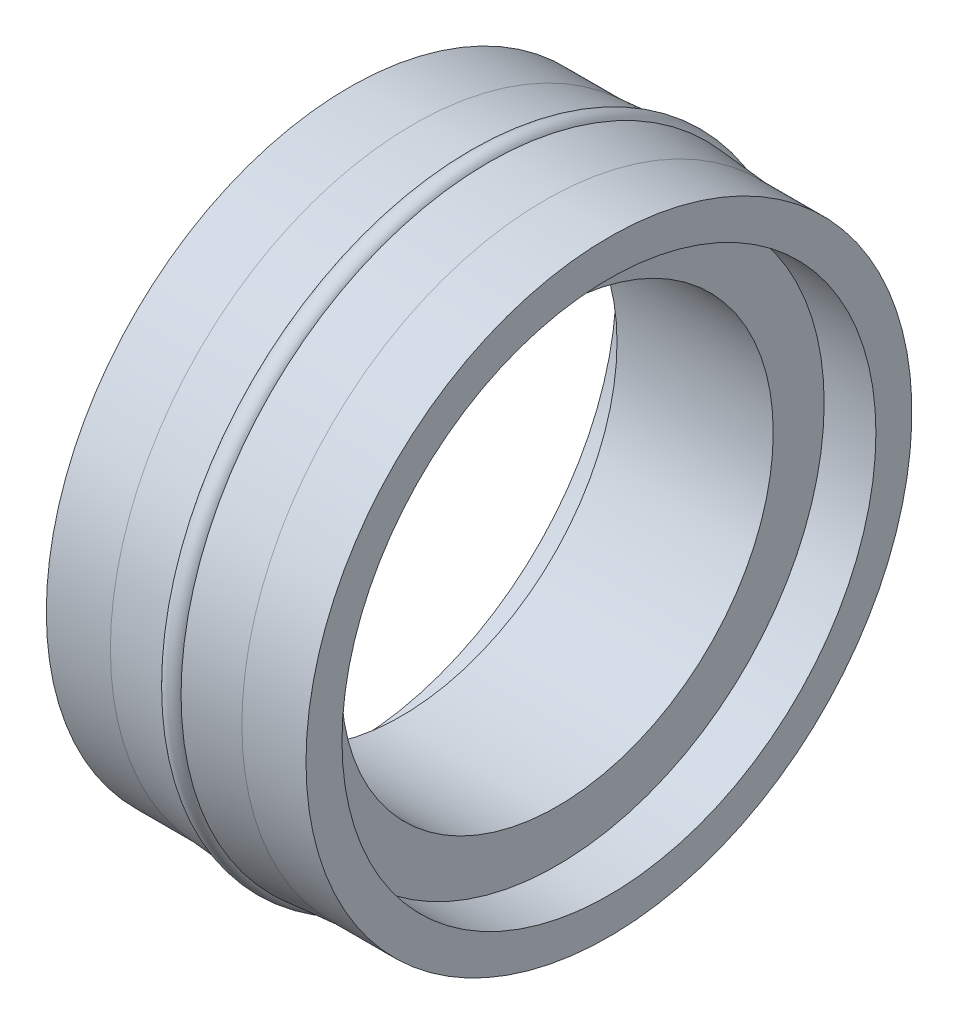
from build123d import *


with BuildPart() as part:
    # Sketch1 → Revolve1 (revolve)
    with BuildSketch(Plane.XY, mode=Mode.PRIVATE) as revolve1_sk:
        with BuildLine():
            Line((12, 24.5), (12, 21.591227021))
            Line((12, 21.591227021), (16.182938488, 21.591227021))
            Line((16.182938488, 21.591227021), (16.182938488, 17.471972716))
            Line((16.182938488, 17.471972716), (28.817061512, 17.471972716))
            Line((28.817061512, 17.471972716), (28.817061512, 21.591227021))
            Line((28.817061512, 21.591227021), (33.001856356, 21.591227021))
            Line((33.001856356, 21.591227021), (33.001856356, 24.5))
            Line((33.001856356, 24.5), (33, 24.5))
            Line((33, 24.5), (27.817061512, 24.5))
            Line((27.817061512, 24.5), (24.746847829, 24.753346743))
            Line((24.746847829, 24.753346743), (23.272118433, 24.875037911))
            ThreePointArc((23.272118433, 24.875037911), (22.5, 25.299429712), (21.727881567, 24.875037911))
            Line((21.727881567, 24.875037911), (20.253152171, 24.753346743))
            Line((20.253152171, 24.753346743), (17.182938488, 24.5))
            Line((17.182938488, 24.5), (12, 24.5))
        make_face()
    revolve(revolve1_sk.sketch.rotate(Axis((0, 0, 0), (1, 0, 0)), 90), axis=Axis((0, 0, 0), (1, 0, 0)))


solid = part.part
